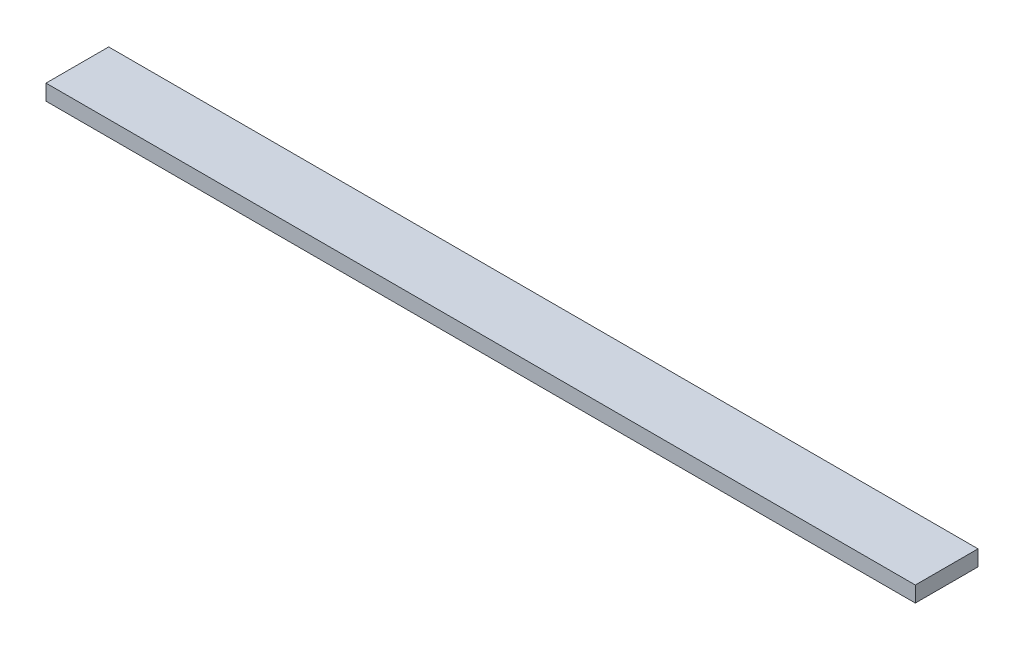
from build123d import *

# Parameters (mm, degrees)
SKETCH1_W           = 176.149
SKETCH1_H           = 12.7
BOSS_EXTRUDE1_DEPTH = 3.175


with BuildPart() as part:
    # Sketch1 → Boss-Extrude1 (new body)
    with BuildSketch(Plane(origin=(0, 0, 0), x_dir=(1, 0, 0), z_dir=(0, 1, 0))):
        Rectangle(SKETCH1_W, SKETCH1_H)
    extrude(amount=BOSS_EXTRUDE1_DEPTH)


solid = part.part
